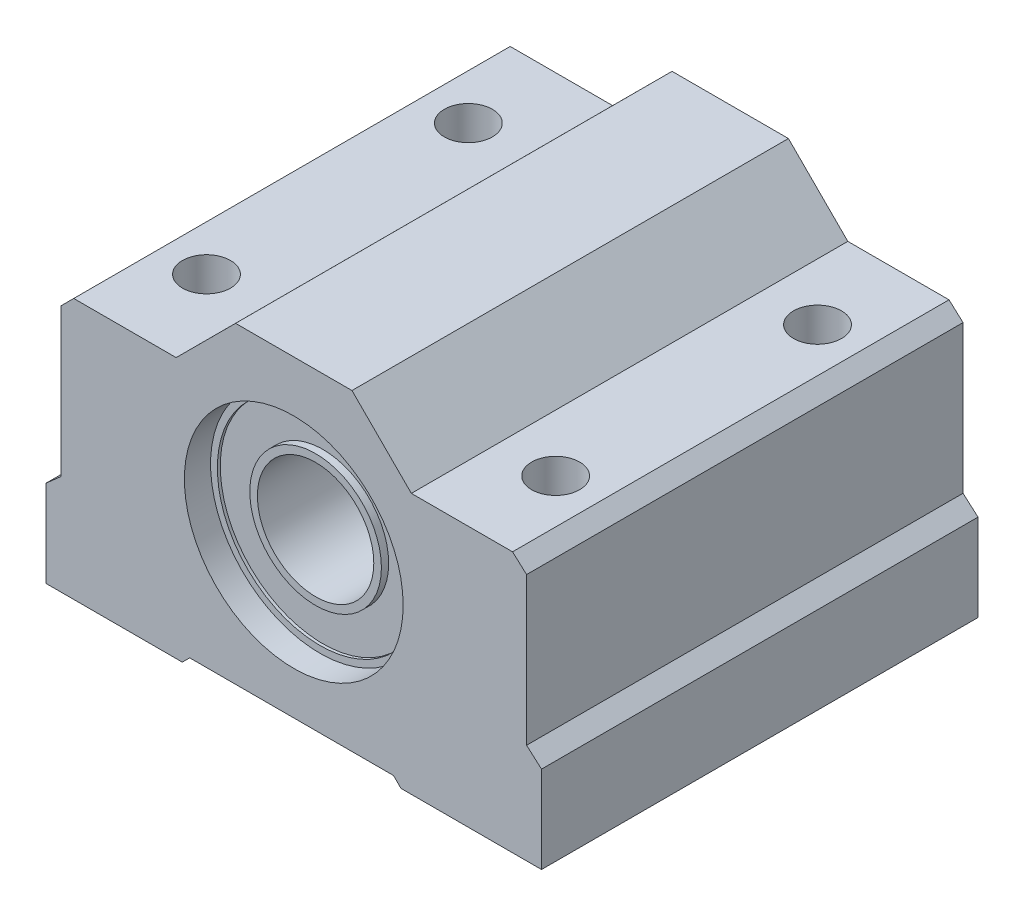
from build123d import *

# Parameters (mm, degrees)
ESQUISSE1_R             = 7.519017315
BOSS_EXTRU_1_DEPTH      = 30
ESQUISSE1_3_R           = 7.051788316
ESQUISSE1_3_R_2         = 4.523392982
BOSS_EXTRU_2_DEPTH      = 28
ESQUISSE1_4_R           = 7.519017315
ESQUISSE1_4_R_2         = 7.051788316
BOSS_EXTRU_3_DEPTH      = 30
ESQUISSE1_5_R           = 4.523392982
ESQUISSE1_5_R_2         = 4
BOSS_EXTRU_4_DEPTH      = 28.5
ESQUISSE1_6_R           = 4.523392982
ESQUISSE1_6_R_2         = 4
ENL_V_MAT_EXTRU_1_DEPTH = 1.5
ESQUISSE1_7_R           = 7.051788316
ESQUISSE1_7_R_2         = 4.523392982
ENL_V_MAT_EXTRU_2_DEPTH = 2
ESQUISSE1_8_R           = 7.519017315
ESQUISSE1_8_R_2         = 7.051788316
ENL_V_MAT_EXTRU_3_DEPTH = 1.8
ENL_V_START             = -28.2
ESQUISSE1_9_R           = 7.519017315
ESQUISSE1_9_R_2         = 7.051788316
ENL_V_MAT_EXTRU_4_DEPTH = 1.8
ESQUISSE2_R             = 1.65
ENL_V_MAT_EXTRU_5_DEPTH = 21.8


with BuildPart() as part:
    # Esquisse1 → Boss.-Extru.1 (new body)
    with BuildSketch(Plane.XY):
        Polygon((-15.997216081, -4.089203195), (-17.03, -5.004453984), (-17.03, -10.973805396), (-7.66267479, -10.973805396), (-7.153229177, -10.464359784), (6.857616233, -10.464359784), (7.367061846, -10.973805396), (17.03, -10.973805396), (17.03, -4.995255883), (16.002783919, -4.089203195), (16.002783919, 6.07141612), (15.037454618, 6.944265115), (8.081929489, 6.944265115), (4, 11.026194604), (-4, 11.026194604), (-8.083891517, 6.944265115), (-15.124367087, 6.944265115), (-15.997216081, 6.07141612), align=None)
        Circle(ESQUISSE1_R, mode=Mode.SUBTRACT)
    extrude(amount=-BOSS_EXTRU_1_DEPTH)



with BuildPart() as body_2:
    # Esquisse1<3> → Boss.-Extru.2 (new body)
    with BuildSketch(Plane.XY):
        Circle(ESQUISSE1_3_R)
        Circle(ESQUISSE1_3_R_2, mode=Mode.SUBTRACT)
    extrude(amount=-BOSS_EXTRU_2_DEPTH)


with BuildPart() as part_1:
    add(part.part)

    add(body_2.part)  # Boss.-Extru.3 merges body 2
    # Esquisse1<4> → Boss.-Extru.3 (add)
    with BuildSketch(Plane.XY):
        Circle(ESQUISSE1_4_R)
        Circle(ESQUISSE1_4_R_2, mode=Mode.SUBTRACT)
    extrude(amount=-BOSS_EXTRU_3_DEPTH)

    # Esquisse1<5> → Boss.-Extru.4 (add)
    with BuildSketch(Plane.XY):
        Circle(ESQUISSE1_5_R)
        Circle(ESQUISSE1_5_R_2, mode=Mode.SUBTRACT)
    extrude(amount=-BOSS_EXTRU_4_DEPTH)

    # Esquisse1<6> → Enlèv. mat.-Extru.1 (cut)
    with BuildSketch(Plane.XY):
        Circle(ESQUISSE1_6_R)
        Circle(ESQUISSE1_6_R_2, mode=Mode.SUBTRACT)
    extrude(amount=-ENL_V_MAT_EXTRU_1_DEPTH, mode=Mode.SUBTRACT)

    # Esquisse1<7> → Enlèv. mat.-Extru.2 (cut)
    with BuildSketch(Plane.XY):
        Circle(ESQUISSE1_7_R)
        Circle(ESQUISSE1_7_R_2, mode=Mode.SUBTRACT)
    extrude(amount=-ENL_V_MAT_EXTRU_2_DEPTH, mode=Mode.SUBTRACT)

    # Esquisse1<8> → Enlèv. mat.-Extru.3 (cut)
    with BuildSketch(Plane.XY):
        Circle(ESQUISSE1_8_R)
        Circle(ESQUISSE1_8_R_2, mode=Mode.SUBTRACT)
    extrude(amount=-ENL_V_MAT_EXTRU_3_DEPTH, mode=Mode.SUBTRACT)

    # Esquisse1<9> → Enlèv. mat.-Extru.4 (cut)
    with BuildSketch(Plane.XY.offset(ENL_V_START)):
        Circle(ESQUISSE1_9_R)
        Circle(ESQUISSE1_9_R_2, mode=Mode.SUBTRACT)
    extrude(amount=-ENL_V_MAT_EXTRU_4_DEPTH, mode=Mode.SUBTRACT)

    # Esquisse2 → Enlèv. mat.-Extru.5 (cut)
    with BuildSketch(Plane.XZ.offset(10.973805396)):
        with Locations((-12, -6)):
            Circle(ESQUISSE2_R)
        with Locations((12, -6)):
            Circle(ESQUISSE2_R)
        with Locations((12, -24)):
            Circle(ESQUISSE2_R)
        with Locations((-12, -24)):
            Circle(ESQUISSE2_R)
    extrude(amount=-ENL_V_MAT_EXTRU_5_DEPTH, mode=Mode.SUBTRACT)


solid = part_1.part
